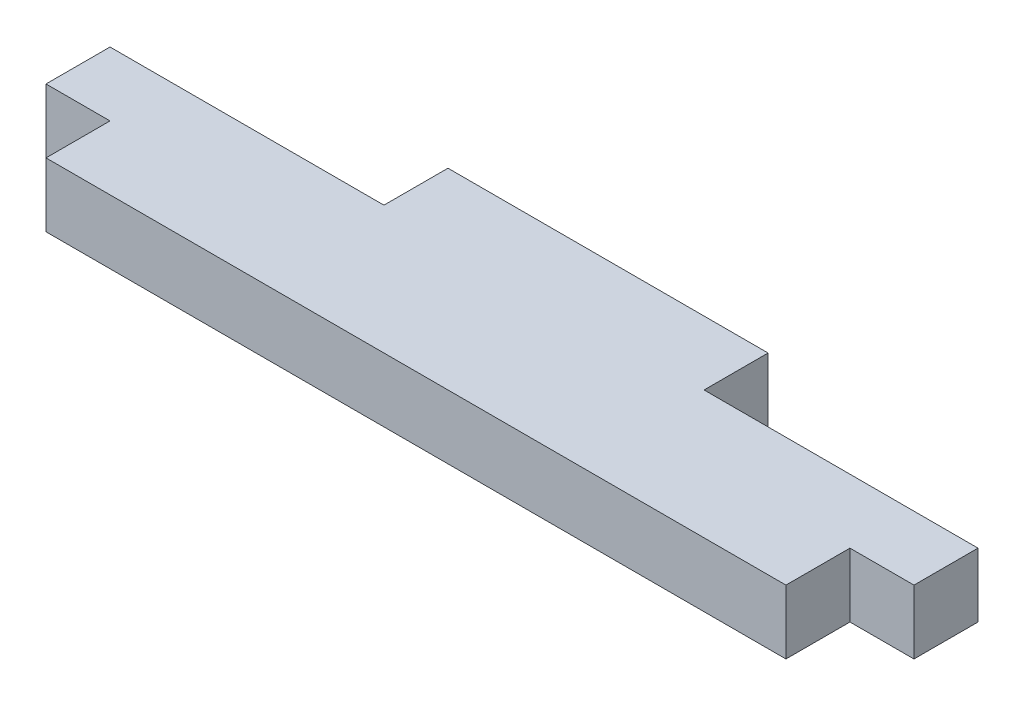
from build123d import *

# Parameters (mm, degrees)
SKETCH1_W           = 67.788084332
SKETCH1_H           = 5
BOSS_EXTRUDE1_DEPTH = 5
SKETCH2_W           = 57.788084332
SKETCH2_H           = 5
BOSS_EXTRUDE2_DEPTH = 5
SKETCH3_W           = 25
SKETCH3_H           = 5
BOSS_EXTRUDE3_DEPTH = 5


with BuildPart() as part:
    # Sketch1 → Boss-Extrude1 (new body)
    with BuildSketch(Plane.XY):
        with Locations((0, -47.5)):
            Rectangle(SKETCH1_W, SKETCH1_H)
    extrude(amount=BOSS_EXTRUDE1_DEPTH)

    # Sketch2 → Boss-Extrude2 (add)
    with BuildSketch(Plane.XY.offset(5)):
        with Locations((0, -47.5)):
            Rectangle(SKETCH2_W, SKETCH2_H)
    extrude(amount=BOSS_EXTRUDE2_DEPTH)

    # Sketch3 → Boss-Extrude3 (add)
    with BuildSketch(Plane.XZ.offset(50)):
        with Locations((0, -2.5)):
            Rectangle(SKETCH3_W, SKETCH3_H)
    extrude(amount=-BOSS_EXTRUDE3_DEPTH)


solid = part.part
